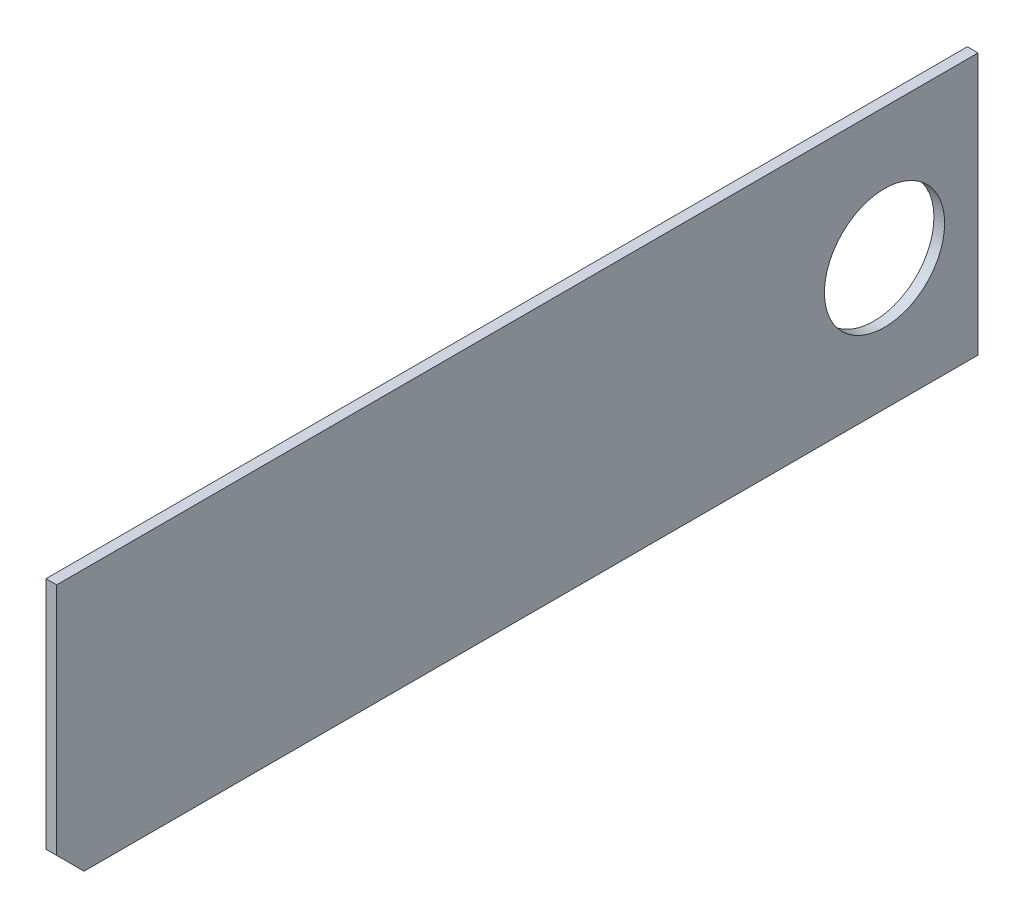
from build123d import *

# Parameters (mm, degrees)
SKETCH_1_R      = 45
EXTRUDE_1_DEPTH = 8


with BuildPart() as part:
    # 草图1 → 凸台-拉伸1 (new body)
    with BuildSketch(Plane(origin=(0, 0, 0), x_dir=(0, 0, -1), z_dir=(1, 0, 0))):
        Polygon((70, 98), (-620, 98), (-620, -77.5), (-599.5, -98), (70, -98), align=None)
        Circle(SKETCH_1_R, mode=Mode.SUBTRACT)
    extrude(amount=EXTRUDE_1_DEPTH)


solid = part.part
